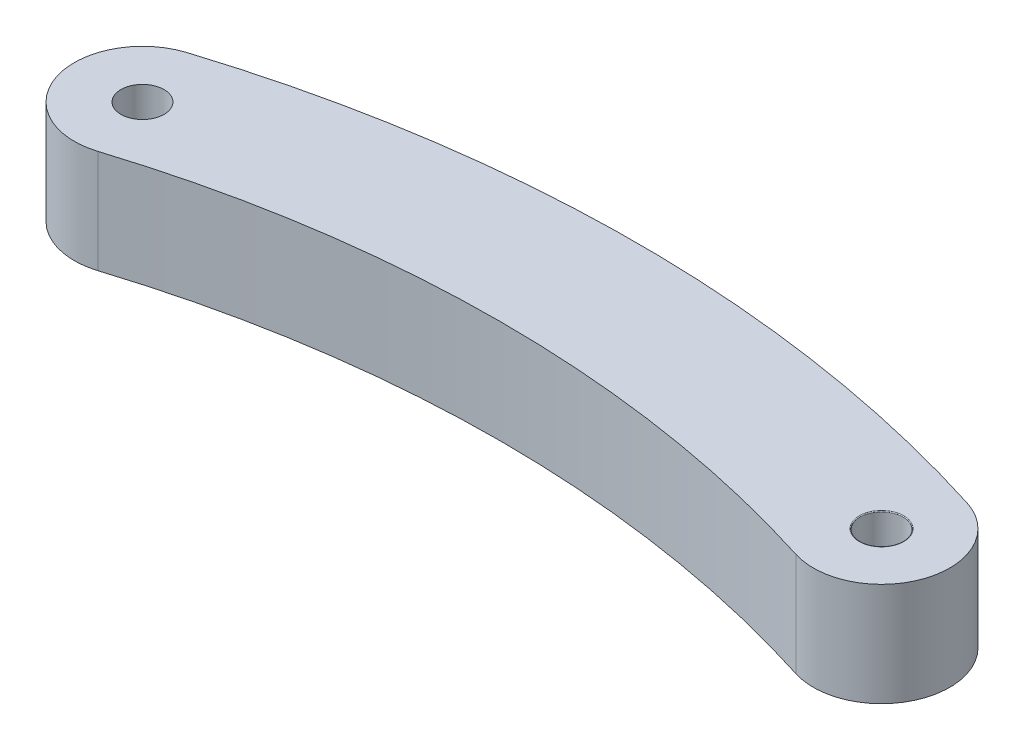
from build123d import *

# Parameters (mm, degrees)
SKETCH1_R           = 2.65
BOSS_EXTRUDE1_DEPTH = 12.7
FILLET1_R           = 0.1


with BuildPart() as part:
    # Sketch1 → Boss-Extrude1 (new body)
    with BuildSketch(Plane(origin=(0, 0, 0), x_dir=(1, 0, 0), z_dir=(0, 1, 0))):
        with BuildLine():
            ThreePointArc((-48.121775191, 3.110386532), (-53.588631165, -7.404473703), (-43.07377093, -12.871329677))
            ThreePointArc((-43.07377093, -12.871329677), (-0.19527306, -6.260471572), (42.683224809, -12.871329677))
            ThreePointArc((42.683224809, -12.871329677), (53.198085044, -7.404473703), (47.73122907, 3.110386532))
            ThreePointArc((47.73122907, 3.110386532), (-0.19527306, 10.499528428), (-48.121775191, 3.110386532))
        make_face()
        with Locations(Location((-45.59777306, -4.880471572, 0), (0, 0, 270))):
            Circle(SKETCH1_R, mode=Mode.SUBTRACT)
        with Locations(Location((45.20722694, -4.880471572, 0), (0, 0, 270))):
            Circle(SKETCH1_R, mode=Mode.SUBTRACT)
    extrude(amount=BOSS_EXTRUDE1_DEPTH)

    # Fillet1
    fillet1_edges = [part.edges().sort_by_distance(p)[0] for p in [
        (45.20722694, 12.7, 2.230471572),
    ]]
    fillet(fillet1_edges, radius=FILLET1_R)


solid = part.part
